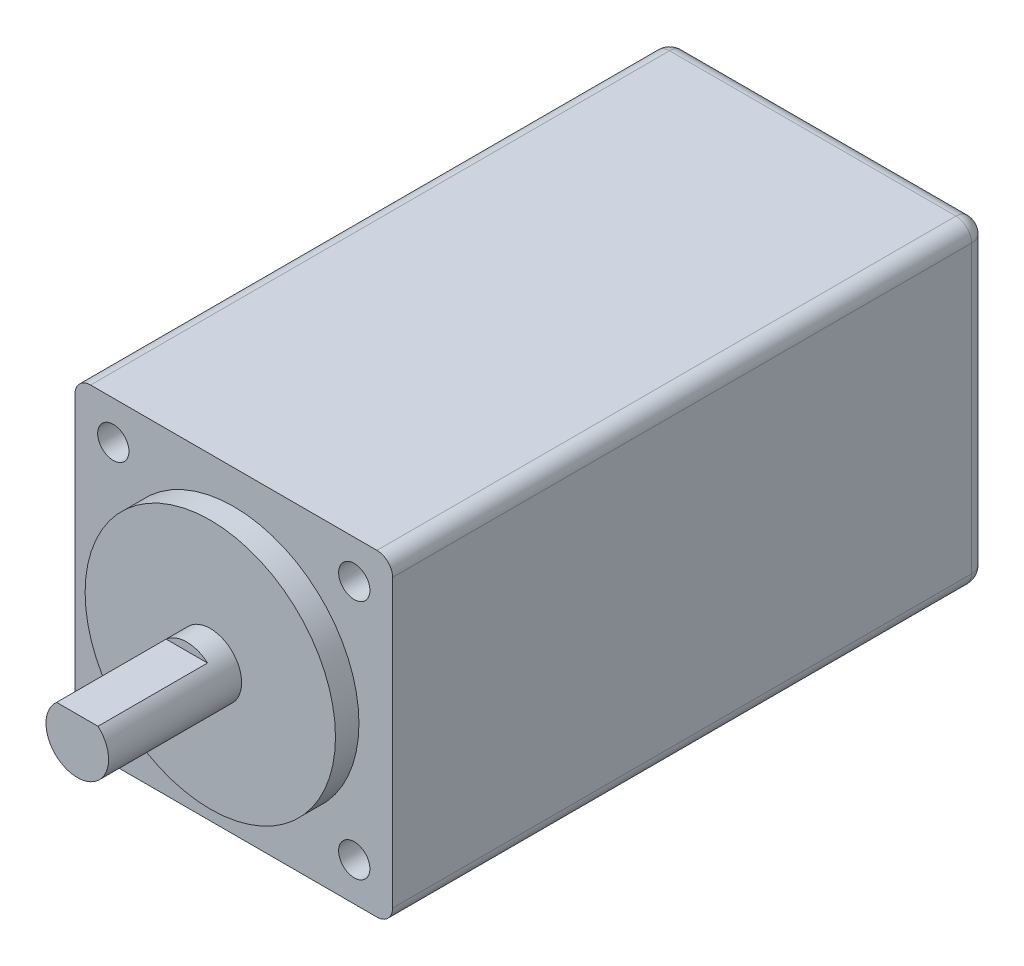
from build123d import *

# Parameters (mm, degrees)
SKETCH1_W           = 20.3
SKETCH1_H           = 20.3
BOSS_EXTRUDE1_DEPTH = 38
SKETCH2_R           = 8
BOSS_EXTRUDE2_DEPTH = 1.5
SKETCH3_R           = 2
BOSS_EXTRUDE3_DEPTH = 8.5
SKETCH4_W           = 7
SKETCH4_H           = 0.5
CUT_EXTRUDE1_DEPTH  = 5
SKETCH5_R           = 1
CUT_EXTRUDE2_DEPTH  = 2.5
FILLET1_R           = 1


with BuildPart() as part:
    # Sketch1 → Boss-Extrude1 (new body)
    with BuildSketch(Plane.XY):
        Rectangle(SKETCH1_W, SKETCH1_H)
    extrude(amount=BOSS_EXTRUDE1_DEPTH)

    # Sketch2 → Boss-Extrude2 (add)
    with BuildSketch(Plane.XY.offset(38)):
        with Locations(Location((0, 0, 0), (0, 0, 180))):
            Circle(SKETCH2_R)
    extrude(amount=BOSS_EXTRUDE2_DEPTH)

    # Sketch3 → Boss-Extrude3 (add)
    with BuildSketch(Plane.XY.offset(39.5)):
        Circle(SKETCH3_R)
    extrude(amount=BOSS_EXTRUDE3_DEPTH)

    # Sketch4 → Cut-Extrude1 (cut, symmetric)
    with BuildSketch(Plane(origin=(0, 0, 0), x_dir=(0, 0, -1), z_dir=(1, 0, 0))):
        with Locations((-44.5, 1.75)):
            Rectangle(SKETCH4_W, SKETCH4_H)
    extrude(amount=CUT_EXTRUDE1_DEPTH, both=True, mode=Mode.SUBTRACT)

    # Sketch5 → Cut-Extrude2 (cut)
    with BuildSketch(Plane.XY.offset(38)):
        with Locations((-7.7, 7.7)):
            Circle(SKETCH5_R)
        with Locations((7.7, 7.7)):
            Circle(SKETCH5_R)
        with Locations((7.7, -7.7)):
            Circle(SKETCH5_R)
        with Locations((-7.7, -7.7)):
            Circle(SKETCH5_R)
    extrude(amount=-CUT_EXTRUDE2_DEPTH, mode=Mode.SUBTRACT)

    # Fillet1
    fillet1_edges = [part.edges().sort_by_distance(p)[0] for p in [
        (0, -10.15, 0),
        (-10.15, 0, 0),
        (0, 10.15, 0),
        (10.15, 0, 0),
        (10.15, -10.15, 19),
        (-10.15, -10.15, 19),
        (-10.15, 10.15, 19),
        (10.15, 10.15, 19),
    ]]
    fillet(fillet1_edges, radius=FILLET1_R)


solid = part.part
